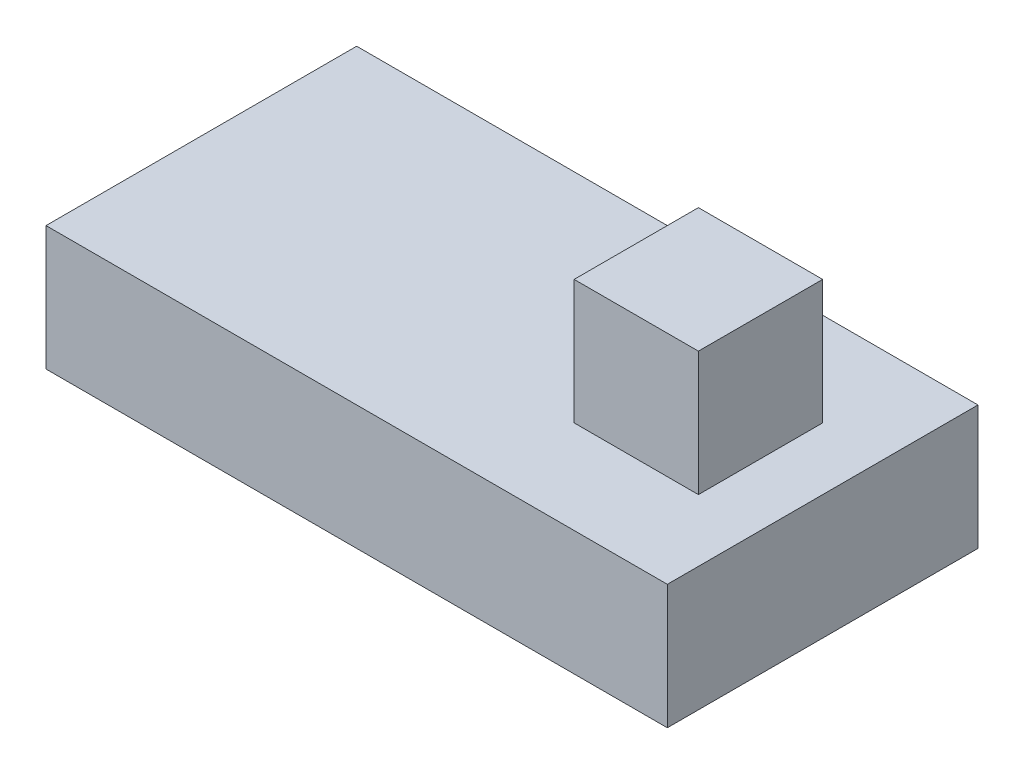
from build123d import *

# Parameters (mm, degrees)
SKETCH_1_W      = 200
SKETCH_1_H      = 100
EXTRUDE_1_DEPTH = 40
SKETCH_2_W      = 40
SKETCH_2_H      = 40
EXTRUDE_2_DEPTH = 40


with BuildPart() as part:
    # Эскиз1 → Бобышка-Вытянуть1 (new body)
    with BuildSketch(Plane(origin=(0, 0, 0), x_dir=(1, 0, 0), z_dir=(0, 1, 0))):
        with Locations((100, 50)):
            Rectangle(SKETCH_1_W, SKETCH_1_H)
    extrude(amount=EXTRUDE_1_DEPTH)

    # Эскиз2 → Бобышка-Вытянуть2 (add)
    with BuildSketch(Plane(origin=(0, 40, 0), x_dir=(1, 0, 0), z_dir=(0, 1, 0))):
        with Locations((160, 50)):
            Rectangle(SKETCH_2_W, SKETCH_2_H)
    extrude(amount=EXTRUDE_2_DEPTH)


solid = part.part
